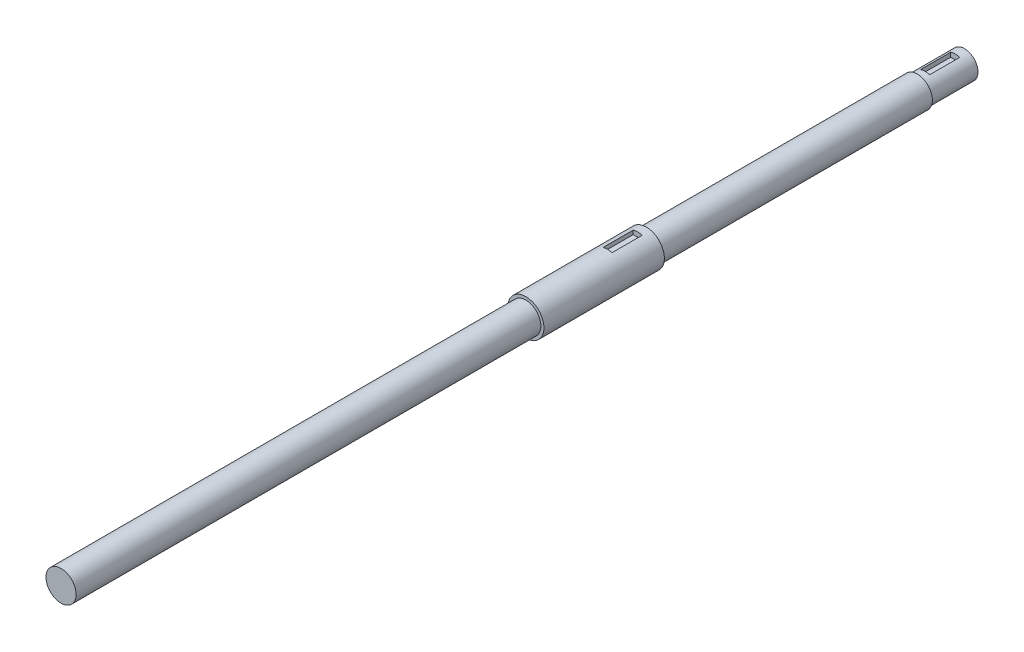
from build123d import *

# Parameters (mm, degrees)
SKETCH7_W          = 10
SKETCH7_H          = 1.5
CUT_EXTRUDE4_DEPTH = 1.5
SKETCH8_W          = 10
SKETCH8_H          = 1.7
CUT_EXTRUDE5_DEPTH = 1.5


with BuildPart() as part:
    # Sketch1 → Revolve1 (revolve)
    with BuildSketch(Plane(origin=(0, 0, 0), x_dir=(0, 0, -1), z_dir=(1, 0, 0)), mode=Mode.PRIVATE) as revolve1_sk:
        Polygon((-134.992104591, 0), (165.007895409, 0), (165.007895409, 4.5), (149.357384883, 4.5), (149.357384883, 5), (59.357384883, 5), (59.357384883, 6), (19.357384883, 6), (19.357384883, 5), (-134.992104591, 5), align=None)
    revolve(revolve1_sk.sketch.rotate(Axis((0, 0, 134.992104591), (0, 0, -1)), 90), axis=Axis((0, 0, 134.992104591), (0, 0, -1)))

    # Sketch7 → Cut-Extrude4 (cut, symmetric)
    with BuildSketch(Plane(origin=(0, 0, 0), x_dir=(0, 0, -1), z_dir=(1, 0, 0))):
        with Locations((51.512242661, 5.25)):
            Rectangle(SKETCH7_W, SKETCH7_H)
    extrude(amount=CUT_EXTRUDE4_DEPTH, both=True, mode=Mode.SUBTRACT)

    # Sketch8 → Cut-Extrude5 (cut, symmetric)
    with BuildSketch(Plane(origin=(0, 0, 0), x_dir=(0, 0, -1), z_dir=(1, 0, 0))):
        with Locations((156.934482796, 3.65)):
            Rectangle(SKETCH8_W, SKETCH8_H)
    extrude(amount=CUT_EXTRUDE5_DEPTH, both=True, mode=Mode.SUBTRACT)


solid = part.part
